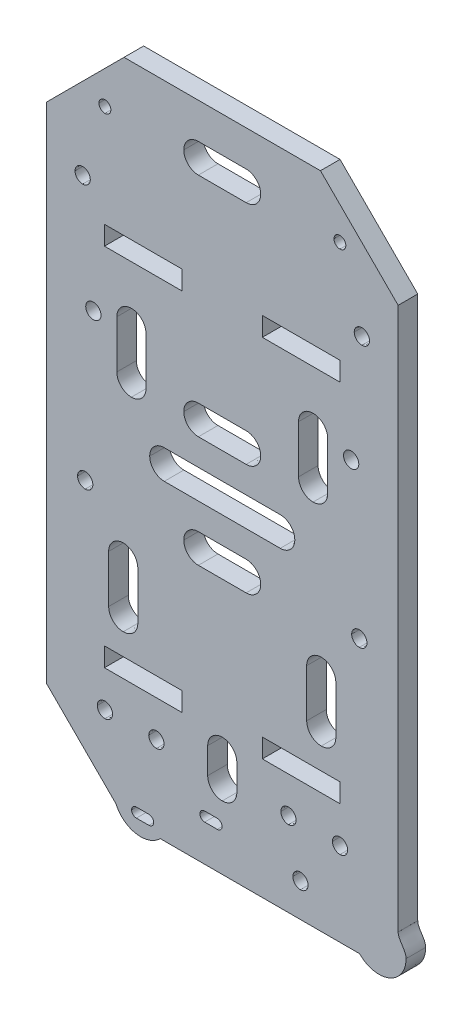
from build123d import *

# Parameters (mm, degrees)
MODEL_R             = 2.47435
MODEL_W             = 25.2003
MODEL_H             = 6.1503
MODEL_W_2           = 25.1989
MODEL_H_2           = 6.1504
BOSS_EXTRUDE1_DEPTH = 6.35


with BuildPart() as part:
    # Model → Boss-Extrude1 (new body)
    with BuildSketch(Plane.XY):
        with BuildLine():
            Line((212.9157, 163.4013), (187.7152, 138.2012))
            Line((187.7152, 138.2012), (187.7152, -24.9816))
            Line((187.7152, -24.9816), (210.2785, -47.5428))
            add(Edge.make_bspline(
                [(210.2785, -47.5428), (211.6324, -50.6488), (214.7305, -52.8217), (218.3354, -52.8217)],
                knots=[0.2, 0.2, 0.2, 0.2, 0.266666667, 0.266666667, 0.266666667, 0.266666667], degree=3))
            add(Edge.make_bspline(
                [(218.3354, -52.8217), (220.7981, -52.8217), (223.0199, -51.8087), (224.6147, -50.1787)],
                knots=[0.266666667, 0.266666667, 0.266666667, 0.266666667, 0.333333333, 0.333333333, 0.333333333, 0.333333333], degree=3))
            Line((224.6147, -50.1787), (289.3019, -50.1637))
            add(Edge.make_bspline(
                [(289.3019, -50.1637), (290.8967, -51.8021), (293.1268, -52.8217), (295.5937, -52.8217)],
                knots=[0.4, 0.4, 0.4, 0.4, 0.466666667, 0.466666667, 0.466666667, 0.466666667], degree=3))
            add(Edge.make_bspline(
                [(295.5937, -52.8217), (298.0481, -52.8217), (300.2659, -51.8158), (301.8606, -50.1941)],
                knots=[0.466666667, 0.466666667, 0.466666667, 0.466666667, 0.533333333, 0.533333333, 0.533333333, 0.533333333], degree=3))
            add(Edge.make_bspline(
                [(301.8606, -50.1941), (303.4221, -48.608), (304.3856, -46.4318), (304.3856, -44.0314)],
                knots=[0.533333333, 0.533333333, 0.533333333, 0.533333333, 0.6, 0.6, 0.6, 0.6], degree=3))
            add(Edge.make_bspline(
                [(304.3856, -44.0314), (304.3856, -41.6085), (301.8315, -40.0711), (301.8191, -37.8264)],
                knots=[0.6, 0.6, 0.6, 0.6, 0.666666667, 0.666666667, 0.666666667, 0.666666667], degree=3))
            Line((301.8191, -37.8264), (301.8149, -37.8235))
            Line((301.8149, -37.8235), (301.8149, 138.2012))
            Line((301.8149, 138.2012), (276.6145, 163.4013))
            Line((276.6145, 163.4013), (212.9157, 163.4013))
        make_face()
        with Locations((202.9651, 87.20105)):
            Circle(MODEL_R, mode=Mode.SUBTRACT)
        with Locations((286.5734, 87.20105)):
            Circle(MODEL_R, mode=Mode.SUBTRACT)
        with Locations((219.16585, 110.25555)):
            Rectangle(MODEL_W, MODEL_H, mode=Mode.SUBTRACT)
        with Locations((270.36755, 110.25555)):
            Rectangle(MODEL_W_2, MODEL_H, mode=Mode.SUBTRACT)
        with Locations((219.16585, -8.1483)):
            Rectangle(MODEL_W, MODEL_H_2, mode=Mode.SUBTRACT)
        with Locations((270.36755, -8.1483)):
            Rectangle(MODEL_W_2, MODEL_H_2, mode=Mode.SUBTRACT)
        with BuildLine():
            Line((220.0256, 89.3636), (220.0256, 73.8666))
            add(Edge.make_bspline(
                [(220.0256, 73.8666), (220.0256, 71.2498), (217.9201, 69.1426), (215.3037, 69.1426)],
                knots=[0.285714286, 0.285714286, 0.285714286, 0.285714286, 0.428571429, 0.428571429, 0.428571429, 0.428571429], degree=3))
            add(Edge.make_bspline(
                [(215.3037, 69.1426), (212.6873, 69.1426), (210.5775, 71.2498), (210.5775, 73.8666)],
                knots=[0.428571429, 0.428571429, 0.428571429, 0.428571429, 0.571428571, 0.571428571, 0.571428571, 0.571428571], degree=3))
            Line((210.5775, 73.8666), (210.5775, 89.3636))
            add(Edge.make_bspline(
                [(210.5775, 89.3636), (210.5775, 91.9808), (212.6873, 94.0893), (215.3037, 94.0893)],
                knots=[0.714285714, 0.714285714, 0.714285714, 0.714285714, 1, 1, 1, 1], degree=3))
            add(Edge.make_bspline(
                [(215.3037, 94.0893), (217.9201, 94.0893), (220.0256, 91.9808), (220.0256, 89.3636)],
                knots=[0, 0, 0, 0, 0.142857143, 0.142857143, 0.142857143, 0.142857143], degree=3))
        make_face(mode=Mode.SUBTRACT)
        with BuildLine():
            Line((278.9568, 89.3636), (278.9568, 73.8666))
            add(Edge.make_bspline(
                [(278.9568, 73.8666), (278.9568, 71.2498), (276.8471, 69.1426), (274.2307, 69.1426)],
                knots=[0.285714286, 0.285714286, 0.285714286, 0.285714286, 0.428571429, 0.428571429, 0.428571429, 0.428571429], degree=3))
            add(Edge.make_bspline(
                [(274.2307, 69.1426), (271.6143, 69.1426), (269.5045, 71.2498), (269.5045, 73.8666)],
                knots=[0.428571429, 0.428571429, 0.428571429, 0.428571429, 0.571428571, 0.571428571, 0.571428571, 0.571428571], degree=3))
            Line((269.5045, 73.8666), (269.5045, 89.3636))
            add(Edge.make_bspline(
                [(269.5045, 89.3636), (269.5045, 91.9808), (271.6143, 94.0893), (274.2307, 94.0893)],
                knots=[0.714285714, 0.714285714, 0.714285714, 0.714285714, 1, 1, 1, 1], degree=3))
            add(Edge.make_bspline(
                [(274.2307, 94.0893), (276.8471, 94.0893), (278.9568, 91.9808), (278.9568, 89.3636)],
                knots=[0, 0, 0, 0, 0.142857143, 0.142857143, 0.142857143, 0.142857143], degree=3))
        make_face(mode=Mode.SUBTRACT)
        with BuildLine():
            Line((239.063, -35.2158), (243.1413, -35.2158))
            add(Edge.make_bspline(
                [(243.1413, -35.2158), (244.0009, -35.2158), (244.6945, -35.9077), (244.6945, -36.7678)],
                knots=[0.142857143, 0.142857143, 0.142857143, 0.142857143, 0.285714286, 0.285714286, 0.285714286, 0.285714286], degree=3))
            add(Edge.make_bspline(
                [(244.6945, -36.7678), (244.6945, -37.6262), (244.0009, -38.3181), (243.1413, -38.3181)],
                knots=[0.285714286, 0.285714286, 0.285714286, 0.285714286, 0.428571429, 0.428571429, 0.428571429, 0.428571429], degree=3))
            Line((243.1413, -38.3181), (239.063, -38.3181))
            add(Edge.make_bspline(
                [(239.063, -38.3181), (238.2033, -38.3181), (237.5139, -37.6262), (237.5139, -36.7678)],
                knots=[0.571428571, 0.571428571, 0.571428571, 0.571428571, 0.714285714, 0.714285714, 0.714285714, 0.714285714], degree=3))
            add(Edge.make_bspline(
                [(237.5139, -36.7678), (237.5139, -35.9077), (238.2033, -35.2158), (239.063, -35.2158)],
                knots=[0.714285714, 0.714285714, 0.714285714, 0.714285714, 1, 1, 1, 1], degree=3))
        make_face(mode=Mode.SUBTRACT)
        with BuildLine():
            Line((237.0197, 42.2282), (252.5146, 42.2282))
            add(Edge.make_bspline(
                [(252.5146, 42.2282), (255.131, 42.2282), (257.2407, 40.1197), (257.2407, 37.5029)],
                knots=[0.285714286, 0.285714286, 0.285714286, 0.285714286, 0.428571429, 0.428571429, 0.428571429, 0.428571429], degree=3))
            add(Edge.make_bspline(
                [(257.2407, 37.5029), (257.2407, 34.8861), (255.131, 32.7776), (252.5146, 32.7776)],
                knots=[0.428571429, 0.428571429, 0.428571429, 0.428571429, 0.571428571, 0.571428571, 0.571428571, 0.571428571], degree=3))
            Line((252.5146, 32.7776), (237.0197, 32.7776))
            add(Edge.make_bspline(
                [(237.0197, 32.7776), (234.4033, 32.7776), (232.2936, 34.8861), (232.2936, 37.5029)],
                knots=[0.714285714, 0.714285714, 0.714285714, 0.714285714, 1, 1, 1, 1], degree=3))
            add(Edge.make_bspline(
                [(232.2936, 37.5029), (232.2936, 40.1197), (234.4033, 42.2282), (237.0197, 42.2282)],
                knots=[0, 0, 0, 0, 0.142857143, 0.142857143, 0.142857143, 0.142857143], degree=3))
        make_face(mode=Mode.SUBTRACT)
        with BuildLine():
            Line((225.9644, 60.2763), (263.574, 60.2763))
            add(Edge.make_bspline(
                [(263.574, 60.2763), (266.1904, 60.2763), (268.296, 58.1695), (268.296, 55.551)],
                knots=[0.285714286, 0.285714286, 0.285714286, 0.285714286, 0.428571429, 0.428571429, 0.428571429, 0.428571429], degree=3))
            add(Edge.make_bspline(
                [(268.296, 55.551), (268.296, 52.9342), (266.1904, 50.827), (263.574, 50.827)],
                knots=[0.428571429, 0.428571429, 0.428571429, 0.428571429, 0.571428571, 0.571428571, 0.571428571, 0.571428571], degree=3))
            Line((263.574, 50.827), (225.9644, 50.827))
            add(Edge.make_bspline(
                [(225.9644, 50.827), (223.3439, 50.827), (221.2383, 52.9342), (221.2383, 55.551)],
                knots=[0.714285714, 0.714285714, 0.714285714, 0.714285714, 1, 1, 1, 1], degree=3))
            add(Edge.make_bspline(
                [(221.2383, 55.551), (221.2383, 58.1695), (223.3439, 60.2763), (225.9644, 60.2763)],
                knots=[0, 0, 0, 0, 0.142857143, 0.142857143, 0.142857143, 0.142857143], degree=3))
        make_face(mode=Mode.SUBTRACT)
        with BuildLine():
            Line((237.0197, 78.3244), (252.5146, 78.3244))
            add(Edge.make_bspline(
                [(252.5146, 78.3244), (255.131, 78.3244), (257.2407, 76.2172), (257.2407, 73.5992)],
                knots=[0.285714286, 0.285714286, 0.285714286, 0.285714286, 0.428571429, 0.428571429, 0.428571429, 0.428571429], degree=3))
            add(Edge.make_bspline(
                [(257.2407, 73.5992), (257.2407, 70.9823), (255.131, 68.8751), (252.5146, 68.8751)],
                knots=[0.428571429, 0.428571429, 0.428571429, 0.428571429, 0.571428571, 0.571428571, 0.571428571, 0.571428571], degree=3))
            Line((252.5146, 68.8751), (237.0197, 68.8751))
            add(Edge.make_bspline(
                [(237.0197, 68.8751), (234.4033, 68.8751), (232.2936, 70.9823), (232.2936, 73.5992)],
                knots=[0.714285714, 0.714285714, 0.714285714, 0.714285714, 1, 1, 1, 1], degree=3))
            add(Edge.make_bspline(
                [(232.2936, 73.5992), (232.2936, 76.2172), (234.4033, 78.3244), (237.0197, 78.3244)],
                knots=[0, 0, 0, 0, 0.142857143, 0.142857143, 0.142857143, 0.142857143], degree=3))
        make_face(mode=Mode.SUBTRACT)
        with BuildLine():
            Line((216.9109, -45.1768), (220.9891, -45.1768))
            add(Edge.make_bspline(
                [(220.9891, -45.1768), (221.8488, -45.1768), (222.5423, -45.8683), (222.5423, -46.7267)],
                knots=[0.142857143, 0.142857143, 0.142857143, 0.142857143, 0.285714286, 0.285714286, 0.285714286, 0.285714286], degree=3))
            add(Edge.make_bspline(
                [(222.5423, -46.7267), (222.5423, -47.5868), (221.8488, -48.2787), (220.9891, -48.2787)],
                knots=[0.285714286, 0.285714286, 0.285714286, 0.285714286, 0.428571429, 0.428571429, 0.428571429, 0.428571429], degree=3))
            Line((220.9891, -48.2787), (216.9109, -48.2787))
            add(Edge.make_bspline(
                [(216.9109, -48.2787), (216.0512, -48.2787), (215.3618, -47.5868), (215.3618, -46.7267)],
                knots=[0.571428571, 0.571428571, 0.571428571, 0.571428571, 0.714285714, 0.714285714, 0.714285714, 0.714285714], degree=3))
            add(Edge.make_bspline(
                [(215.3618, -46.7267), (215.3618, -45.8683), (216.0512, -45.1768), (216.9109, -45.1768)],
                knots=[0.714285714, 0.714285714, 0.714285714, 0.714285714, 1, 1, 1, 1], degree=3))
        make_face(mode=Mode.SUBTRACT)
        with BuildLine():
            Line((217.3802, 22.1596), (217.3802, 6.6627))
            add(Edge.make_bspline(
                [(217.3802, 6.6627), (217.3802, 4.0454), (215.2746, 1.9386), (212.6582, 1.9386)],
                knots=[0.285714286, 0.285714286, 0.285714286, 0.285714286, 0.428571429, 0.428571429, 0.428571429, 0.428571429], degree=3))
            add(Edge.make_bspline(
                [(212.6582, 1.9386), (210.0418, 1.9386), (207.9321, 4.0454), (207.9321, 6.6627)],
                knots=[0.428571429, 0.428571429, 0.428571429, 0.428571429, 0.571428571, 0.571428571, 0.571428571, 0.571428571], degree=3))
            Line((207.9321, 6.6627), (207.9321, 22.1596))
            add(Edge.make_bspline(
                [(207.9321, 22.1596), (207.9321, 24.7764), (210.0418, 26.8849), (212.6582, 26.8849)],
                knots=[0.714285714, 0.714285714, 0.714285714, 0.714285714, 1, 1, 1, 1], degree=3))
            add(Edge.make_bspline(
                [(212.6582, 26.8849), (215.2746, 26.8849), (217.3802, 24.7764), (217.3802, 22.1596)],
                knots=[0, 0, 0, 0, 0.142857143, 0.142857143, 0.142857143, 0.142857143], degree=3))
        make_face(mode=Mode.SUBTRACT)
        with BuildLine():
            Line((281.6022, 22.1596), (281.6022, 6.6627))
            add(Edge.make_bspline(
                [(281.6022, 6.6627), (281.6022, 4.0454), (279.4925, 1.9386), (276.8761, 1.9386)],
                knots=[0.285714286, 0.285714286, 0.285714286, 0.285714286, 0.428571429, 0.428571429, 0.428571429, 0.428571429], degree=3))
            add(Edge.make_bspline(
                [(276.8761, 1.9386), (274.2597, 1.9386), (272.15, 4.0454), (272.15, 6.6627)],
                knots=[0.428571429, 0.428571429, 0.428571429, 0.428571429, 0.571428571, 0.571428571, 0.571428571, 0.571428571], degree=3))
            Line((272.15, 6.6627), (272.15, 22.1596))
            add(Edge.make_bspline(
                [(272.15, 22.1596), (272.15, 24.7764), (274.2597, 26.8849), (276.8761, 26.8849)],
                knots=[0.714285714, 0.714285714, 0.714285714, 0.714285714, 1, 1, 1, 1], degree=3))
            add(Edge.make_bspline(
                [(276.8761, 26.8849), (279.4925, 26.8849), (281.6022, 24.7764), (281.6022, 22.1596)],
                knots=[0, 0, 0, 0, 0.142857143, 0.142857143, 0.142857143, 0.142857143], degree=3))
        make_face(mode=Mode.SUBTRACT)
        with BuildLine():
            Line((249.4912, -16.3591), (249.4912, -24.7955))
            add(Edge.make_bspline(
                [(249.4912, -24.7955), (249.4912, -27.4123), (247.3856, -29.5208), (244.7692, -29.5208)],
                knots=[0.285714286, 0.285714286, 0.285714286, 0.285714286, 0.428571429, 0.428571429, 0.428571429, 0.428571429], degree=3))
            add(Edge.make_bspline(
                [(244.7692, -29.5208), (242.1487, -29.5208), (240.0431, -27.4123), (240.0431, -24.7955)],
                knots=[0.428571429, 0.428571429, 0.428571429, 0.428571429, 0.571428571, 0.571428571, 0.571428571, 0.571428571], degree=3))
            Line((240.0431, -24.7955), (240.0431, -16.3591))
            add(Edge.make_bspline(
                [(240.0431, -16.3591), (240.0431, -13.7406), (242.1487, -11.6338), (244.7692, -11.6338)],
                knots=[0.714285714, 0.714285714, 0.714285714, 0.714285714, 1, 1, 1, 1], degree=3))
            add(Edge.make_bspline(
                [(244.7692, -11.6338), (247.3856, -11.6338), (249.4912, -13.7406), (249.4912, -16.3591)],
                knots=[0, 0, 0, 0, 0.142857143, 0.142857143, 0.142857143, 0.142857143], degree=3))
        make_face(mode=Mode.SUBTRACT)
        with BuildLine():
            Line((237.0197, 151.8231), (252.5146, 151.8231))
            add(Edge.make_bspline(
                [(252.5146, 151.8231), (255.131, 151.8231), (257.2407, 149.7163), (257.2407, 147.0982)],
                knots=[0.285714286, 0.285714286, 0.285714286, 0.285714286, 0.428571429, 0.428571429, 0.428571429, 0.428571429], degree=3))
            add(Edge.make_bspline(
                [(257.2407, 147.0982), (257.2407, 144.481), (255.131, 142.3742), (252.5146, 142.3742)],
                knots=[0.428571429, 0.428571429, 0.428571429, 0.428571429, 0.571428571, 0.571428571, 0.571428571, 0.571428571], degree=3))
            Line((252.5146, 142.3742), (237.0197, 142.3742))
            add(Edge.make_bspline(
                [(237.0197, 142.3742), (234.4033, 142.3742), (232.2936, 144.481), (232.2936, 147.0982)],
                knots=[0.714285714, 0.714285714, 0.714285714, 0.714285714, 1, 1, 1, 1], degree=3))
            add(Edge.make_bspline(
                [(232.2936, 147.0982), (232.2936, 149.7163), (234.4033, 151.8231), (237.0197, 151.8231)],
                knots=[0, 0, 0, 0, 0.142857143, 0.142857143, 0.142857143, 0.142857143], degree=3))
        make_face(mode=Mode.SUBTRACT)
        with BuildLine():
            add(Edge.make_bspline(
                [(208.6381, 146.4724), (208.6381, 145.4088), (207.7784, 144.547), (206.7111, 144.547)],
                knots=[0, 0, 0, 0, 0.2, 0.2, 0.2, 0.2], degree=3))
            add(Edge.make_bspline(
                [(206.7111, 144.547), (205.6521, 144.547), (204.7882, 145.4088), (204.7882, 146.4724)],
                knots=[0.2, 0.2, 0.2, 0.2, 0.4, 0.4, 0.4, 0.4], degree=3))
            add(Edge.make_bspline(
                [(204.7882, 146.4724), (204.7882, 147.5347), (205.6521, 148.3973), (206.7111, 148.3973)],
                knots=[0.4, 0.4, 0.4, 0.4, 0.6, 0.6, 0.6, 0.6], degree=3))
            add(Edge.make_bspline(
                [(206.7111, 148.3973), (207.7784, 148.3973), (208.6381, 147.5347), (208.6381, 146.4724)],
                knots=[0.6, 0.6, 0.6, 0.6, 1, 1, 1, 1], degree=3))
        make_face(mode=Mode.SUBTRACT)
        with BuildLine():
            add(Edge.make_bspline(
                [(284.8374, 146.4724), (284.8374, 145.4088), (283.9778, 144.547), (282.9146, 144.547)],
                knots=[0, 0, 0, 0, 0.2, 0.2, 0.2, 0.2], degree=3))
            add(Edge.make_bspline(
                [(282.9146, 144.547), (281.8514, 144.547), (280.9876, 145.4088), (280.9876, 146.4724)],
                knots=[0.2, 0.2, 0.2, 0.2, 0.4, 0.4, 0.4, 0.4], degree=3))
            add(Edge.make_bspline(
                [(280.9876, 146.4724), (280.9876, 147.5347), (281.8514, 148.3973), (282.9146, 148.3973)],
                knots=[0.4, 0.4, 0.4, 0.4, 0.6, 0.6, 0.6, 0.6], degree=3))
            add(Edge.make_bspline(
                [(282.9146, 148.3973), (283.9778, 148.3973), (284.8374, 147.5347), (284.8374, 146.4724)],
                knots=[0.6, 0.6, 0.6, 0.6, 1, 1, 1, 1], degree=3))
        make_face(mode=Mode.SUBTRACT)
        with BuildLine():
            add(Edge.make_bspline(
                [(201.9642, 123.5586), (201.9642, 124.9253), (200.8595, 126.0321), (199.4932, 126.0321)],
                knots=[0, 0, 0, 0, 0.2, 0.2, 0.2, 0.2], degree=3))
            add(Edge.make_bspline(
                [(199.4932, 126.0321), (198.1268, 126.0321), (197.018, 124.9253), (197.018, 123.5586)],
                knots=[0.2, 0.2, 0.2, 0.2, 0.4, 0.4, 0.4, 0.4], degree=3))
            add(Edge.make_bspline(
                [(197.018, 123.5586), (197.018, 122.1926), (198.1268, 121.0846), (199.4932, 121.0846)],
                knots=[0.4, 0.4, 0.4, 0.4, 0.6, 0.6, 0.6, 0.6], degree=3))
            add(Edge.make_bspline(
                [(199.4932, 121.0846), (200.8595, 121.0846), (201.9642, 122.1926), (201.9642, 123.5586)],
                knots=[0.6, 0.6, 0.6, 0.6, 1, 1, 1, 1], degree=3))
        make_face(mode=Mode.SUBTRACT)
        with BuildLine():
            add(Edge.make_bspline(
                [(292.5163, 123.5586), (292.5163, 124.9253), (291.4075, 126.0321), (290.0412, 126.0321)],
                knots=[0, 0, 0, 0, 0.2, 0.2, 0.2, 0.2], degree=3))
            add(Edge.make_bspline(
                [(290.0412, 126.0321), (288.6748, 126.0321), (287.5701, 124.9253), (287.5701, 123.5586)],
                knots=[0.2, 0.2, 0.2, 0.2, 0.4, 0.4, 0.4, 0.4], degree=3))
            add(Edge.make_bspline(
                [(287.5701, 123.5586), (287.566, 122.1926), (288.6748, 121.0846), (290.0412, 121.0846)],
                knots=[0.4, 0.4, 0.4, 0.4, 0.6, 0.6, 0.6, 0.6], degree=3))
            add(Edge.make_bspline(
                [(290.0412, 121.0846), (291.4075, 121.0846), (292.5163, 122.1926), (292.5163, 123.5586)],
                knots=[0.6, 0.6, 0.6, 0.6, 1, 1, 1, 1], degree=3))
        make_face(mode=Mode.SUBTRACT)
        with BuildLine():
            add(Edge.make_bspline(
                [(202.7907, 38.3019), (202.7907, 39.6691), (201.6818, 40.7771), (200.3155, 40.7771)],
                knots=[0, 0, 0, 0, 0.2, 0.2, 0.2, 0.2], degree=3))
            add(Edge.make_bspline(
                [(200.3155, 40.7771), (198.9491, 40.7771), (197.8444, 39.6691), (197.8444, 38.3019)],
                knots=[0.2, 0.2, 0.2, 0.2, 0.4, 0.4, 0.4, 0.4], degree=3))
            add(Edge.make_bspline(
                [(197.8444, 38.3019), (197.8444, 36.9364), (198.9491, 35.8284), (200.3155, 35.8284)],
                knots=[0.4, 0.4, 0.4, 0.4, 0.6, 0.6, 0.6, 0.6], degree=3))
            add(Edge.make_bspline(
                [(200.3155, 35.8284), (201.6818, 35.8284), (202.7907, 36.9364), (202.7907, 38.3019)],
                knots=[0.6, 0.6, 0.6, 0.6, 1, 1, 1, 1], degree=3))
        make_face(mode=Mode.SUBTRACT)
        with BuildLine():
            add(Edge.make_bspline(
                [(291.6899, 38.3019), (291.6899, 39.6691), (290.581, 40.7771), (289.2189, 40.7771)],
                knots=[0, 0, 0, 0, 0.2, 0.2, 0.2, 0.2], degree=3))
            add(Edge.make_bspline(
                [(289.2189, 40.7771), (287.8484, 40.7771), (286.7437, 39.6691), (286.7437, 38.3019)],
                knots=[0.2, 0.2, 0.2, 0.2, 0.4, 0.4, 0.4, 0.4], degree=3))
            add(Edge.make_bspline(
                [(286.7437, 38.3019), (286.7437, 36.9364), (287.8484, 35.8284), (289.2189, 35.8284)],
                knots=[0.4, 0.4, 0.4, 0.4, 0.6, 0.6, 0.6, 0.6], degree=3))
            add(Edge.make_bspline(
                [(289.2189, 35.8284), (290.581, 35.8284), (291.6899, 36.9364), (291.6899, 38.3019)],
                knots=[0.6, 0.6, 0.6, 0.6, 1, 1, 1, 1], degree=3))
        make_face(mode=Mode.SUBTRACT)
        with BuildLine():
            add(Edge.make_bspline(
                [(209.1863, -22.9719), (209.1863, -21.6052), (208.0816, -20.4984), (206.7111, -20.4984)],
                knots=[0, 0, 0, 0, 0.2, 0.2, 0.2, 0.2], degree=3))
            add(Edge.make_bspline(
                [(206.7111, -20.4984), (205.3489, -20.4984), (204.2401, -21.6052), (204.2401, -22.9719)],
                knots=[0.2, 0.2, 0.2, 0.2, 0.4, 0.4, 0.4, 0.4], degree=3))
            add(Edge.make_bspline(
                [(204.2401, -22.9719), (204.2401, -24.3379), (205.3489, -25.4459), (206.7111, -25.4459)],
                knots=[0.4, 0.4, 0.4, 0.4, 0.6, 0.6, 0.6, 0.6], degree=3))
            add(Edge.make_bspline(
                [(206.7111, -25.4459), (208.0816, -25.4459), (209.1863, -24.3379), (209.1863, -22.9719)],
                knots=[0.6, 0.6, 0.6, 0.6, 1, 1, 1, 1], degree=3))
        make_face(mode=Mode.SUBTRACT)
        with BuildLine():
            add(Edge.make_bspline(
                [(225.8772, -22.9719), (225.8772, -21.6052), (224.7684, -20.4984), (223.402, -20.4984)],
                knots=[0, 0, 0, 0, 0.2, 0.2, 0.2, 0.2], degree=3))
            add(Edge.make_bspline(
                [(223.402, -20.4984), (222.0357, -20.4984), (220.9268, -21.6052), (220.9268, -22.9719)],
                knots=[0.2, 0.2, 0.2, 0.2, 0.4, 0.4, 0.4, 0.4], degree=3))
            add(Edge.make_bspline(
                [(220.9268, -22.9719), (220.9268, -24.3379), (222.0357, -25.4459), (223.402, -25.4459)],
                knots=[0.4, 0.4, 0.4, 0.4, 0.6, 0.6, 0.6, 0.6], degree=3))
            add(Edge.make_bspline(
                [(223.402, -25.4459), (224.7684, -25.4459), (225.8772, -24.3379), (225.8772, -22.9719)],
                knots=[0.6, 0.6, 0.6, 0.6, 1, 1, 1, 1], degree=3))
        make_face(mode=Mode.SUBTRACT)
        with BuildLine():
            add(Edge.make_bspline(
                [(268.7238, -22.9719), (268.7238, -21.6052), (267.6149, -20.4984), (266.2486, -20.4984)],
                knots=[0, 0, 0, 0, 0.2, 0.2, 0.2, 0.2], degree=3))
            add(Edge.make_bspline(
                [(266.2486, -20.4984), (264.8822, -20.4984), (263.7775, -21.6052), (263.7775, -22.9719)],
                knots=[0.2, 0.2, 0.2, 0.2, 0.4, 0.4, 0.4, 0.4], degree=3))
            add(Edge.make_bspline(
                [(263.7775, -22.9719), (263.7775, -24.3379), (264.8822, -25.4459), (266.2486, -25.4459)],
                knots=[0.4, 0.4, 0.4, 0.4, 0.6, 0.6, 0.6, 0.6], degree=3))
            add(Edge.make_bspline(
                [(266.2486, -25.4459), (267.6149, -25.4459), (268.7238, -24.3379), (268.7238, -22.9719)],
                knots=[0.6, 0.6, 0.6, 0.6, 1, 1, 1, 1], degree=3))
        make_face(mode=Mode.SUBTRACT)
        with BuildLine():
            add(Edge.make_bspline(
                [(285.4313, -23.0164), (285.4313, -21.6492), (284.3225, -20.5424), (282.9561, -20.5424)],
                knots=[0, 0, 0, 0, 0.2, 0.2, 0.2, 0.2], degree=3))
            add(Edge.make_bspline(
                [(282.9561, -20.5424), (281.5898, -20.5424), (280.4851, -21.6492), (280.4851, -23.0164)],
                knots=[0.2, 0.2, 0.2, 0.2, 0.4, 0.4, 0.4, 0.4], degree=3))
            add(Edge.make_bspline(
                [(280.4851, -23.0164), (280.4851, -24.3819), (281.5898, -25.4899), (282.9561, -25.4899)],
                knots=[0.4, 0.4, 0.4, 0.4, 0.6, 0.6, 0.6, 0.6], degree=3))
            add(Edge.make_bspline(
                [(282.9561, -25.4899), (284.3225, -25.4899), (285.4313, -24.3819), (285.4313, -23.0164)],
                knots=[0.6, 0.6, 0.6, 0.6, 1, 1, 1, 1], degree=3))
        make_face(mode=Mode.SUBTRACT)
        with BuildLine():
            add(Edge.make_bspline(
                [(272.6068, -39.3132), (272.6068, -37.9473), (271.498, -36.8392), (270.1316, -36.8392)],
                knots=[0, 0, 0, 0, 0.2, 0.2, 0.2, 0.2], degree=3))
            add(Edge.make_bspline(
                [(270.1316, -36.8392), (268.7653, -36.8392), (267.6606, -37.9473), (267.6606, -39.3132)],
                knots=[0.2, 0.2, 0.2, 0.2, 0.4, 0.4, 0.4, 0.4], degree=3))
            add(Edge.make_bspline(
                [(267.6606, -39.3132), (267.6606, -40.6787), (268.7653, -41.7867), (270.1316, -41.7867)],
                knots=[0.4, 0.4, 0.4, 0.4, 0.6, 0.6, 0.6, 0.6], degree=3))
            add(Edge.make_bspline(
                [(270.1316, -41.7867), (271.498, -41.7867), (272.6068, -40.6799), (272.6068, -39.3132)],
                knots=[0.6, 0.6, 0.6, 0.6, 1, 1, 1, 1], degree=3))
        make_face(mode=Mode.SUBTRACT)
    extrude(amount=BOSS_EXTRUDE1_DEPTH)


solid = part.part
